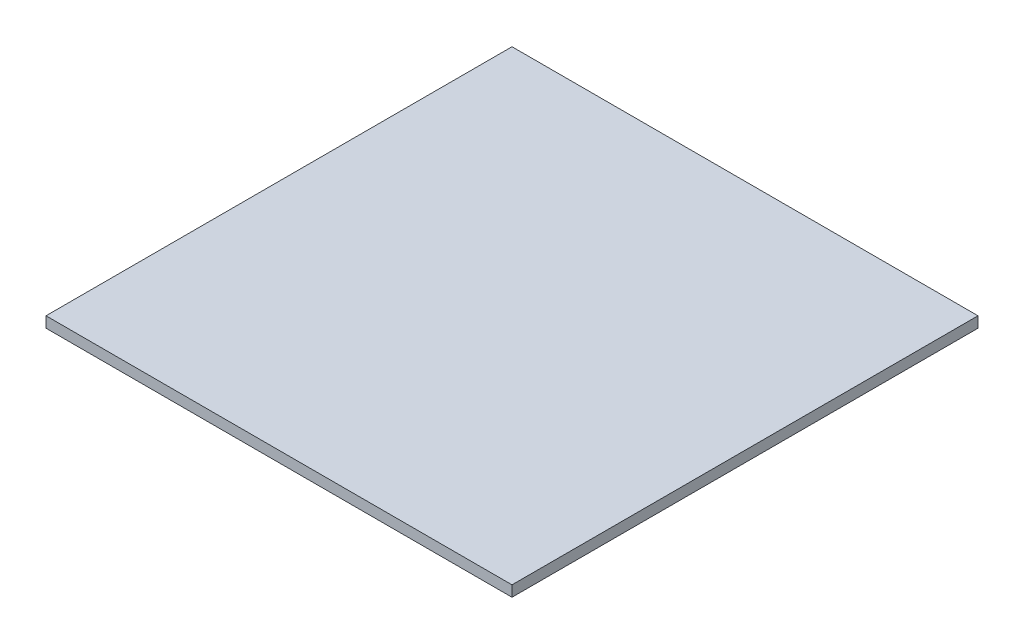
from build123d import *

# Parameters (mm, degrees)
SKETCH1_W           = 241.3
SKETCH1_H           = 241.3
BOSS_EXTRUDE1_DEPTH = 5.588


with BuildPart() as part:
    # Sketch1 → Boss-Extrude1 (new body)
    with BuildSketch(Plane(origin=(0, 0, 0), x_dir=(1, 0, 0), z_dir=(0, 1, 0))):
        with Locations((21.593531254, 40.226856185)):
            Rectangle(SKETCH1_W, SKETCH1_H)
    extrude(amount=BOSS_EXTRUDE1_DEPTH)


solid = part.part
